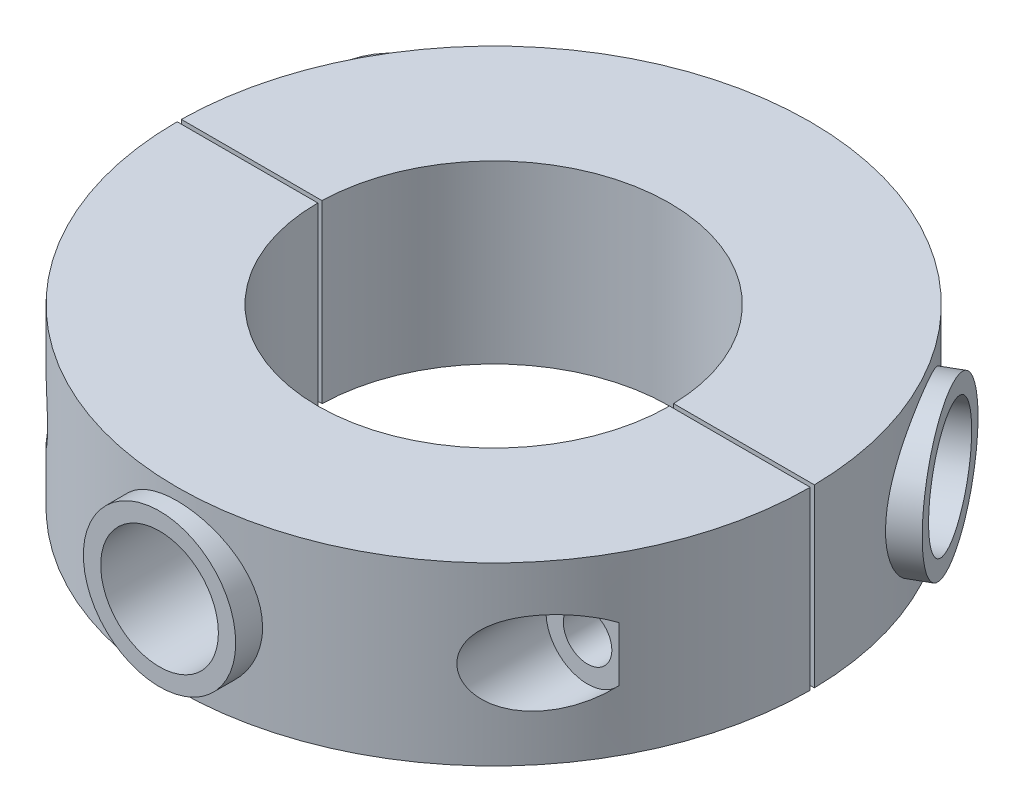
from build123d import *

# Parameters (mm, degrees)
SKETCH1_R                = 22.86
SKETCH1_R_2              = 12.7
BOSS_EXTRUDE1_DEPTH      = 12.7
BOSS_EXTRUDE2_REACH      = 55.777
BOSS_EXTRUDE2_END_RADIUS = 22.86
SKETCH4_R                = 5.5
CUT_EXTRUDE3_START       = 17.78
SKETCH2_R                = 4.25
CUT_EXTRUDE3_DEPTH       = 6.35
CIRPATTERN1_COUNT        = 3
SKETCH5_R                = 2.6
CUT_EXTRUDE4_DEPTH       = 4.2
SKETCH5_3_R              = 2.6
CUT_EXTRUDE5_DEPTH       = 0.3
CUT_EXTRUDE6_REACH       = 38.093
CUT_EXTRUDE6_END_RADIUS  = 22.86
SKETCH6_R                = 1.75
CUT_EXTRUDE7_START       = -11
SKETCH6_3_R              = 3
CUT_EXTRUDE7_DEPTH       = 26.09344329


with BuildPart() as part:
    # Sketch1 → Boss-Extrude1 (new body)
    with BuildSketch(Plane(origin=(0, 0, 0), x_dir=(1, 0, 0), z_dir=(0, 1, 0))):
        with Locations(Location((0, 0, 0), (0, 0, 270))):
            Circle(SKETCH1_R)
        with Locations(Location((0, 0, 0), (0, 0, 270))):
            Circle(SKETCH1_R_2, mode=Mode.SUBTRACT)
    extrude(amount=BOSS_EXTRUDE1_DEPTH)

    # Boss-Extrude2: up to this cylinder (the profile starts outside it)
    boss_extrude2_end = Plane(origin=(0, 6.35, 0), z_dir=(0, -1, 0)) * Cylinder(BOSS_EXTRUDE2_END_RADIUS, 158.274, mode=Mode.PRIVATE)
    # Sketch4 → Boss-Extrude2 (add, up to the surface)
    with BuildSketch(Plane.XY.offset(24.13), mode=Mode.PRIVATE) as boss_extrude2_sk1:
        with Locations((0, 6.35)):
            Circle(SKETCH4_R)
    boss_extrude2_tool1 = extrude(boss_extrude2_sk1.sketch, amount=-BOSS_EXTRUDE2_REACH, mode=Mode.PRIVATE) - boss_extrude2_end
    boss_extrude2 = boss_extrude2_tool1.solids().sort_by_distance((0, 6.35, 24.13))[0]
    add(boss_extrude2)

    # Sketch2 → Cut-Extrude3 (cut)
    with BuildSketch(Plane.XY.offset(CUT_EXTRUDE3_START)):
        with Locations((0, 6.35)):
            Circle(SKETCH2_R)
    cut_extrude3 = extrude(amount=CUT_EXTRUDE3_DEPTH, mode=Mode.SUBTRACT)

    # CirPattern1: Boss-Extrude2, Cut-Extrude3 ×3 about axis
    cirpattern1_axis = Axis((0, 0, 0), (0, 1, 0))
    add([boss_extrude2.rotate(cirpattern1_axis, i * 360 / CIRPATTERN1_COUNT) for i in range(1, CIRPATTERN1_COUNT)])
    add([cut_extrude3.rotate(cirpattern1_axis, i * 360 / CIRPATTERN1_COUNT) for i in range(1, CIRPATTERN1_COUNT)], mode=Mode.SUBTRACT)


with BuildPart() as body_2:
    # Split1: the piece on the far side of the plane
    add(part.part)
    split(bisect_by=Plane.XY, keep=Keep.BOTTOM)

    # Sketch5 → Cut-Extrude4 (cut)
    with BuildSketch(Plane.XY):
        with Locations((17.78, 6.35)):
            Circle(SKETCH5_R)
        with Locations((-17.78, 6.35)):
            Circle(SKETCH5_R)
    extrude(amount=-CUT_EXTRUDE4_DEPTH, mode=Mode.SUBTRACT)

    # Sketch5<3> → Cut-Extrude5 (cut)
    with BuildSketch(Plane.XY):
        Polygon((22.86, 12.7), (12.7, 12.7), (-22.86, 12.7), (-22.86, 0), (12.7, 0), (22.86, 0), align=None)
        with Locations((-17.78, 6.35)):
            Circle(SKETCH5_3_R, mode=Mode.SUBTRACT)
        with Locations((17.78, 6.35)):
            Circle(SKETCH5_3_R, mode=Mode.SUBTRACT)
    extrude(amount=-CUT_EXTRUDE5_DEPTH, mode=Mode.SUBTRACT)


with BuildPart() as part_1:
    add(part.part)

    # Split1
    split(bisect_by=Plane.XY, keep=Keep.TOP)

    # Cut-Extrude6: up to this cylinder (the profile starts inside it)
    cut_extrude6_end = Plane(origin=(0, 6.35, 0), z_dir=(0, -1, 0)) * Cylinder(CUT_EXTRUDE6_END_RADIUS, 122.906, mode=Mode.PRIVATE)
    # Sketch6 → Cut-Extrude6 (cut, up to the surface)
    with BuildSketch(Plane(origin=(0, 0, 0), x_dir=(-1, 0, 0), z_dir=(0, 0, -1)), mode=Mode.PRIVATE) as cut_extrude6_sk1:
        with Locations((-17.78, 6.35)):
            Circle(SKETCH6_R)
    cut_extrude6_tool1 = extrude(cut_extrude6_sk1.sketch, amount=-CUT_EXTRUDE6_REACH, mode=Mode.PRIVATE) & cut_extrude6_end
    add(cut_extrude6_tool1.solids().sort_by_distance((17.78, 6.35, 0))[0], mode=Mode.SUBTRACT)
    # Sketch6 → Cut-Extrude6 (cut, up to the surface)
    with BuildSketch(Plane(origin=(0, 0, 0), x_dir=(-1, 0, 0), z_dir=(0, 0, -1)), mode=Mode.PRIVATE) as cut_extrude6_sk2:
        with Locations((17.78, 6.35)):
            Circle(SKETCH6_R)
    cut_extrude6_tool2 = extrude(cut_extrude6_sk2.sketch, amount=-CUT_EXTRUDE6_REACH, mode=Mode.PRIVATE) & cut_extrude6_end
    add(cut_extrude6_tool2.solids().sort_by_distance((-17.78, 6.35, 0))[0], mode=Mode.SUBTRACT)

    # Sketch6<3> → Cut-Extrude7 (cut, through all)
    with BuildSketch(Plane(origin=(0, 0, 0), x_dir=(-1, 0, 0), z_dir=(0, 0, -1)).offset(CUT_EXTRUDE7_START)):
        with Locations((-17.78, 6.35)):
            Circle(SKETCH6_3_R)
        with Locations((17.78, 6.35)):
            Circle(SKETCH6_3_R)
    extrude(amount=-CUT_EXTRUDE7_DEPTH, mode=Mode.SUBTRACT)


solid = Compound([body_2.part, part_1.part])
